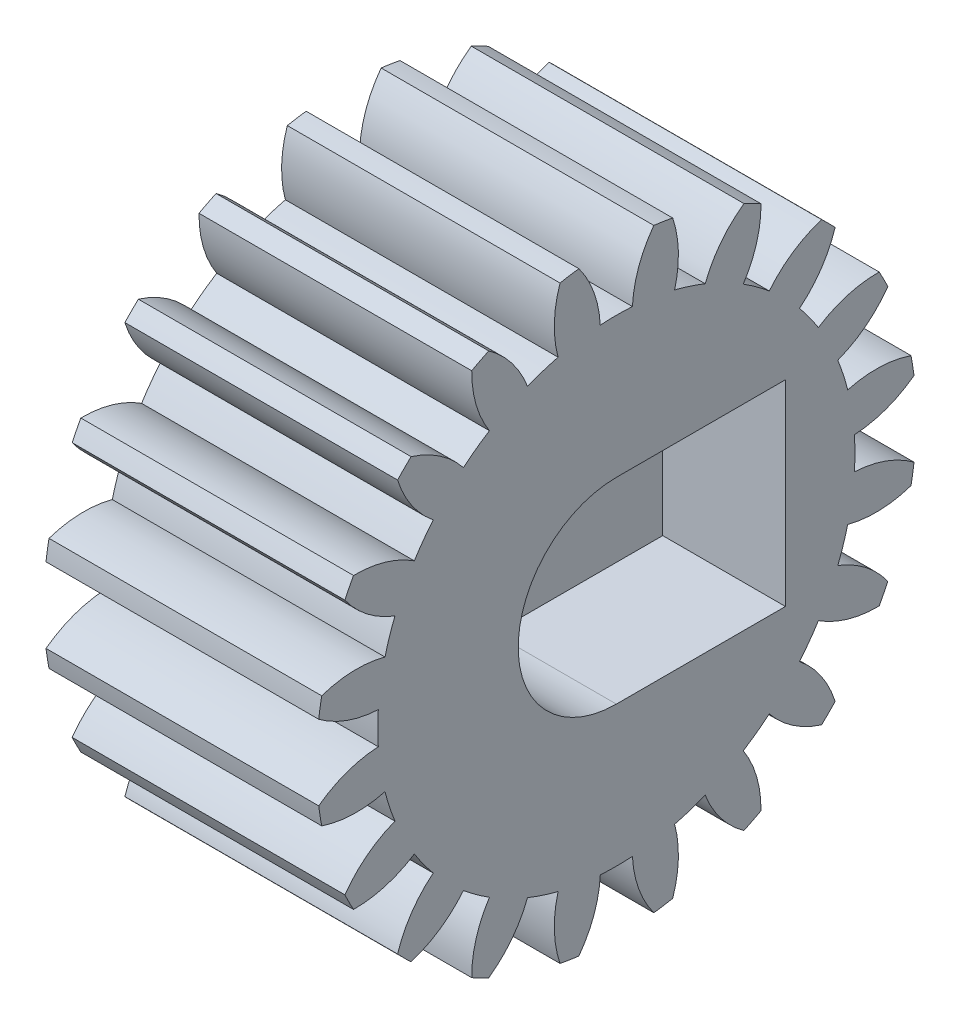
from build123d import *

# Parameters (mm, degrees)
BASPROSKE_W        = 10
BASPROSKE_H        = 11
TOOTHCUT_DEPTH     = 19.493242009
TEETHCUTS_COUNT    = 20
TEETHCUTS_ANGLE    = 342
BORSKE_R           = 0.75
BORE_DEPTH         = 50.0000508
CUT_EXTRUDE1_DEPTH = 4.5
SKETCH2_R          = 1.3
CUT_EXTRUDE2_DEPTH = 10
SKETCH3_R          = 3
CUT_EXTRUDE3_DEPTH = 0.5


with BuildPart() as part:
    # BasProSke → Base-Revolve (revolve)
    with BuildSketch(Plane(origin=(0, 0, 0), x_dir=(1, 0, 0), z_dir=(0, 1, 0)), mode=Mode.PRIVATE) as base_revolve_sk:
        with Locations((5, 5.5)):
            Rectangle(BASPROSKE_W, BASPROSKE_H)
    revolve(base_revolve_sk.sketch.rotate(Axis((-10, 0, 0), (1, 0, 0)), 180), axis=Axis((-10, 0, 0), (1, 0, 0)))

    # TooCutSke → ToothCut (cut, through all)
    with BuildSketch(Plane(origin=(0, 0, 0), x_dir=(0, 0, -1), z_dir=(1, 0, 0))):
        with BuildLine():
            ThreePointArc((0.589353609, 8.729127295), (0, 8.749), (-0.589353609, 8.729127295))
            ThreePointArc((-0.589353609, 8.729127295), (-0.82475631, 9.893403384), (-1.391689312, 10.937213814))
            ThreePointArc((-1.391689312, 10.937213814), (0, 11.0254), (1.391689312, 10.937213814))
            ThreePointArc((1.391689312, 10.937213814), (0.82475631, 9.893403384), (0.589353609, 8.729127295))
        make_face()
    toothcut = extrude(amount=TOOTHCUT_DEPTH, mode=Mode.SUBTRACT)

    # TeethCuts: ToothCut ×20 about axis
    teethcuts_axis = Axis((-10, 0, 0), (1, 0, 0))
    for i in range(1, TEETHCUTS_COUNT):
        add(toothcut.rotate(teethcuts_axis, i * TEETHCUTS_ANGLE / (TEETHCUTS_COUNT - 1)), mode=Mode.SUBTRACT)

    # BorSke → Bore (cut, symmetric)
    with BuildSketch(Plane(origin=(0, 0, 0), x_dir=(0, 0, -1), z_dir=(1, 0, 0))):
        with Locations(Location((0, 0, 0), (0, 0, 180))):
            Circle(BORSKE_R)
    extrude(amount=BORE_DEPTH, both=True, mode=Mode.SUBTRACT)

    # Sketch1 → Cut-Extrude1 (cut)
    with BuildSketch(Plane(origin=(10, 0, 0), x_dir=(0, 0, -1), z_dir=(1, 0, 0))):
        with BuildLine():
            Line((0, 3.6), (6.2, 3.6))
            Line((6.2, 3.6), (6.2, -3.6))
            Line((6.2, -3.6), (0, -3.6))
            ThreePointArc((0, -3.6), (-3.6, 0), (0, 3.6))
        make_face()
    extrude(amount=-CUT_EXTRUDE1_DEPTH, mode=Mode.SUBTRACT)

    # Sketch2 → Cut-Extrude2 (cut)
    with BuildSketch(Plane.ZY):
        Circle(SKETCH2_R)
    extrude(amount=-CUT_EXTRUDE2_DEPTH, mode=Mode.SUBTRACT)

    # Sketch3 → Cut-Extrude3 (cut)
    with BuildSketch(Plane.ZY):
        Circle(SKETCH3_R)
    extrude(amount=-CUT_EXTRUDE3_DEPTH, mode=Mode.SUBTRACT)


solid = part.part
